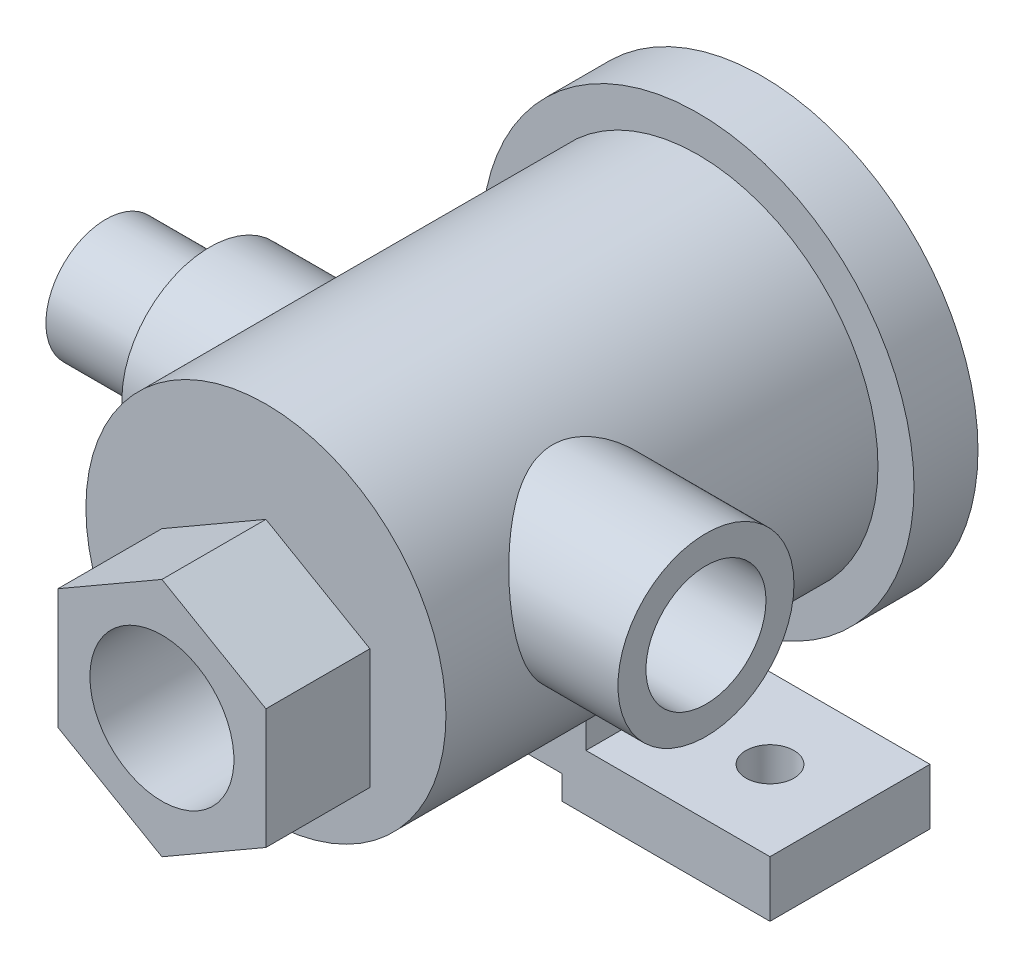
from build123d import *

# Parameters (mm, degrees)
SKETCH_1_R           = 27
EXTRUDE_1_DEPTH      = 8
SKETCH_2_R           = 22.5
EXTRUDE_2_DEPTH      = 54
SKETCH_3_R           = 9
EXTRUDE_3_DEPTH      = 13
SKETCH_4_R           = 15
CUT_EXTRUDE_1_DEPTH  = 56
CUT_EXTRUDE_2_REACH  = 74.815
SKETCH_7_R           = 9
SKETCH_8_W           = 74
SKETCH_8_H           = 20
EXTRUDE_4_DEPTH      = 7
EXTRUDE_5_REACH      = 96.25
EXTRUDE_5_END_RADIUS = 22.5
SKETCH_9_W           = 28
SKETCH_9_H           = 20
CUT_EXTRUDE_3_REACH  = 62.614
SKETCH_10_W          = 22
SKETCH_10_H          = 6
EXTRUDE_7_REACH      = 104.259
EXTRUDE_7_END_RADIUS = 22.5
SKETCH_12_R          = 11
EXTRUDE_8_REACH      = 98.794
EXTRUDE_8_END_RADIUS = 22.5
SKETCH_15_R          = 11
SKETCH_13_R          = 7.5
CUT_EXTRUDE_6_DEPTH  = 56
SKETCH_16_R          = 7.5
EXTRUDE_9_DEPTH      = 13
SKETCH_17_R          = 4
CUT_EXTRUDE_7_DEPTH  = 30
SKETCH_18_R          = 3
CUT_EXTRUDE_8_DEPTH  = 30


with BuildPart() as part:
    # 草图1 → 凸台-拉伸1 (new body)
    with BuildSketch(Plane.XY):
        Circle(SKETCH_1_R)
    extrude(amount=-EXTRUDE_1_DEPTH)

    # 草图2 → 凸台-拉伸2 (add)
    with BuildSketch(Plane.XY):
        Circle(SKETCH_2_R)
    extrude(amount=EXTRUDE_2_DEPTH)

    # 草图3 → 凸台-拉伸3 (add)
    with BuildSketch(Plane.XY.offset(54)):
        Polygon((0, 10.011106999), (-13, 2.505553499), (-13, -12.505553499), (0, -20.011106999), (13, -12.505553499), (13, 2.505553499), align=None)
        with Locations(Location((0, -5, 0), (0, 0, 180))):
            Circle(SKETCH_3_R, mode=Mode.SUBTRACT)
    extrude(amount=EXTRUDE_3_DEPTH)

    # 草图4 → 切除-拉伸1 (cut)
    with BuildSketch(Plane(origin=(0, 0, -8), x_dir=(-1, 0, 0), z_dir=(0, 0, -1))):
        Circle(SKETCH_4_R)
    extrude(amount=-CUT_EXTRUDE_1_DEPTH, mode=Mode.SUBTRACT)

    # 草图7 → 切除-拉伸2 (cut, up to next)
    with BuildSketch(Plane.XY.offset(54), mode=Mode.PRIVATE) as cut_extrude_2_sk1:
        with Locations(Location((0, -5, 0), (0, 0, 180))):
            Circle(SKETCH_7_R)
    cut_extrude_2_tool1 = extrude(cut_extrude_2_sk1.sketch, amount=-CUT_EXTRUDE_2_REACH, mode=Mode.PRIVATE) & part.part
    add(cut_extrude_2_tool1.solids().sort_by_distance((0, -5, 54))[0], mode=Mode.SUBTRACT)

    # 草图8 → 凸台-拉伸4 (add)
    with BuildSketch(Plane(origin=(0, -28, 0), x_dir=(1, 0, 0), z_dir=(0, 1, 0))):
        with Locations((0, -18)):
            Rectangle(SKETCH_8_W, SKETCH_8_H)
    extrude(amount=EXTRUDE_4_DEPTH)

    # 凸台-拉伸5: up to this cylinder (the profile starts outside it)
    extrude_5_end = Plane(origin=(0, 0, 18), z_dir=(0, 0, -1)) * Cylinder(EXTRUDE_5_END_RADIUS, 238.5, mode=Mode.PRIVATE)
    # 草图9 → 凸台-拉伸5 (add, up to the surface)
    with BuildSketch(Plane.XZ.offset(28), mode=Mode.PRIVATE) as extrude_5_sk1:
        with Locations((0, 18)):
            Rectangle(SKETCH_9_W, SKETCH_9_H)
    extrude_5_tool1 = extrude(extrude_5_sk1.sketch, amount=-EXTRUDE_5_REACH, mode=Mode.PRIVATE) - extrude_5_end
    add(extrude_5_tool1.solids().sort_by_distance((0, -28, 18))[0])

    # 草图10 → 切除-拉伸3 (cut, up to next)
    with BuildSketch(Plane.XY.offset(28), mode=Mode.PRIVATE) as cut_extrude_3_sk1:
        with Locations((0, -28)):
            Rectangle(SKETCH_10_W, SKETCH_10_H)
    cut_extrude_3_tool1 = extrude(cut_extrude_3_sk1.sketch, amount=-CUT_EXTRUDE_3_REACH, mode=Mode.PRIVATE) & part.part
    add(cut_extrude_3_tool1.solids().sort_by_distance((0, -28, 28))[0], mode=Mode.SUBTRACT)

    # 凸台-拉伸7: up to this cylinder (the profile starts outside it)
    extrude_7_end = Plane(origin=(0, 0, 34), z_dir=(0, 0, -1)) * Cylinder(EXTRUDE_7_END_RADIUS, 254.518, mode=Mode.PRIVATE)
    # 草图12 → 凸台-拉伸7 (add, up to the surface)
    with BuildSketch(Plane(origin=(35, 0, 0), x_dir=(0, 0, -1), z_dir=(1, 0, 0)), mode=Mode.PRIVATE) as extrude_7_sk1:
        with Locations((-34, 5)):
            Circle(SKETCH_12_R)
    extrude_7_tool1 = extrude(extrude_7_sk1.sketch, amount=-EXTRUDE_7_REACH, mode=Mode.PRIVATE) - extrude_7_end
    add(extrude_7_tool1.solids().sort_by_distance((35, 5, 34))[0])

    # 凸台-拉伸8: up to this cylinder (the profile starts outside it)
    extrude_8_end = Plane(origin=(0, 0, 34), z_dir=(0, 0, -1)) * Cylinder(EXTRUDE_8_END_RADIUS, 243.588, mode=Mode.PRIVATE)
    # 草图15 → 凸台-拉伸8 (add, up to the surface)
    with BuildSketch(Plane(origin=(-27, 0, 0), x_dir=(0, 0, -1), z_dir=(1, 0, 0)), mode=Mode.PRIVATE) as extrude_8_sk1:
        with Locations((-34, 5)):
            Circle(SKETCH_15_R)
    extrude_8_tool1 = extrude(extrude_8_sk1.sketch, amount=EXTRUDE_8_REACH, mode=Mode.PRIVATE) - extrude_8_end
    add(extrude_8_tool1.solids().sort_by_distance((-27, 5, 34))[0])

    # 草图13 → 切除-拉伸6 (cut)
    with BuildSketch(Plane(origin=(35, 0, 0), x_dir=(0, 0, -1), z_dir=(1, 0, 0))):
        with Locations((-34, 5)):
            Circle(SKETCH_13_R)
    extrude(amount=-CUT_EXTRUDE_6_DEPTH, mode=Mode.SUBTRACT)

    # 草图16 → 凸台-拉伸9 (add)
    with BuildSketch(Plane.ZY.offset(27)):
        with Locations(Location((34, 5, 0), (0, 0, 180))):
            Circle(SKETCH_16_R)
    extrude(amount=EXTRUDE_9_DEPTH)

    # 草图17 → 切除-拉伸7 (cut)
    with BuildSketch(Plane.ZY.offset(40)):
        with Locations((34, 5)):
            Circle(SKETCH_17_R)
    extrude(amount=-CUT_EXTRUDE_7_DEPTH, mode=Mode.SUBTRACT)

    # 草图18 → 切除-拉伸8 (cut)
    with BuildSketch(Plane(origin=(0, -21, 0), x_dir=(1, 0, 0), z_dir=(0, 1, 0))):
        with Locations(Location((-27, -18, 0), (0, 0, 270))):
            Circle(SKETCH_18_R)
        with Locations(Location((27, -18, 0), (0, 0, 270))):
            Circle(SKETCH_18_R)
    extrude(amount=-CUT_EXTRUDE_8_DEPTH, mode=Mode.SUBTRACT)


solid = part.part
